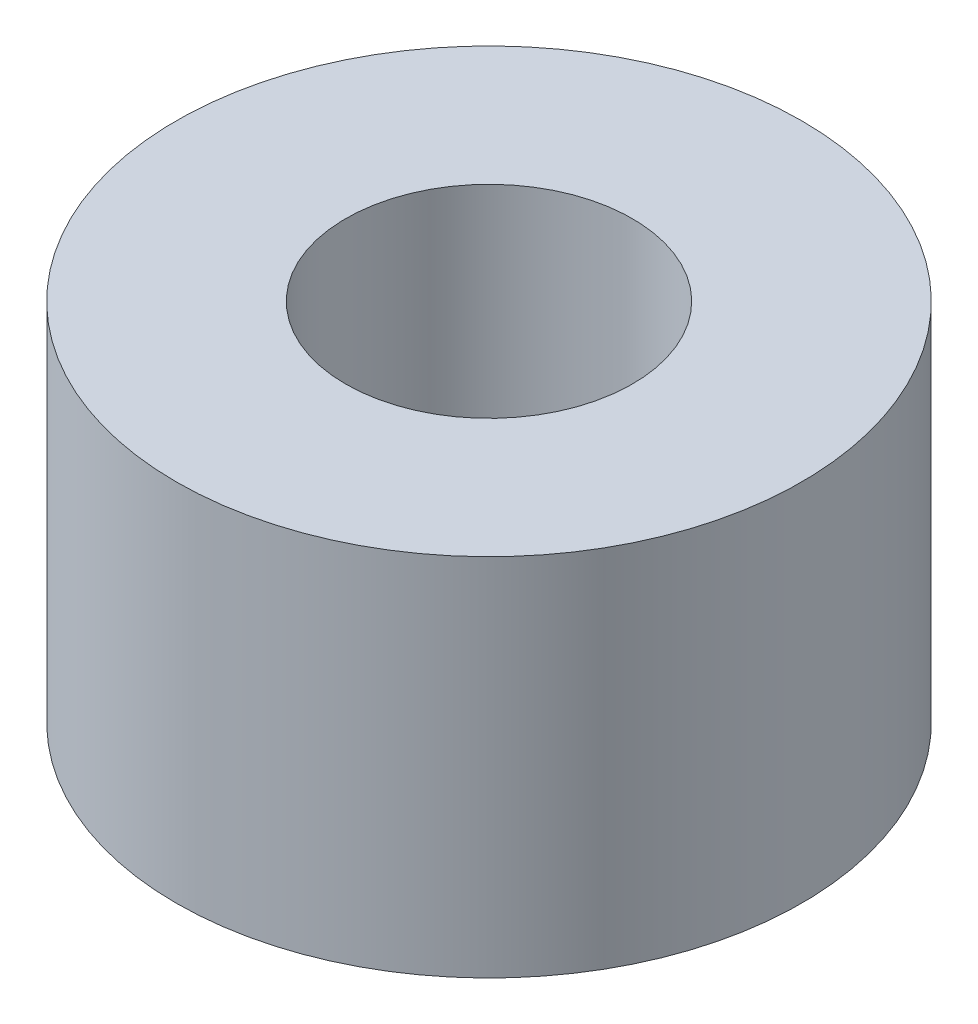
from build123d import *

# Parameters (mm, degrees)
SKETCH1_R           = 2.4
SKETCH1_R_2         = 1.1
BOSS_EXTRUDE1_DEPTH = 2.8


with BuildPart() as part:
    # Sketch1 → Boss-Extrude1 (new body)
    with BuildSketch(Plane(origin=(0, 0, 0), x_dir=(1, 0, 0), z_dir=(0, 1, 0))):
        Circle(SKETCH1_R)
        Circle(SKETCH1_R_2, mode=Mode.SUBTRACT)
    extrude(amount=BOSS_EXTRUDE1_DEPTH)


solid = part.part
